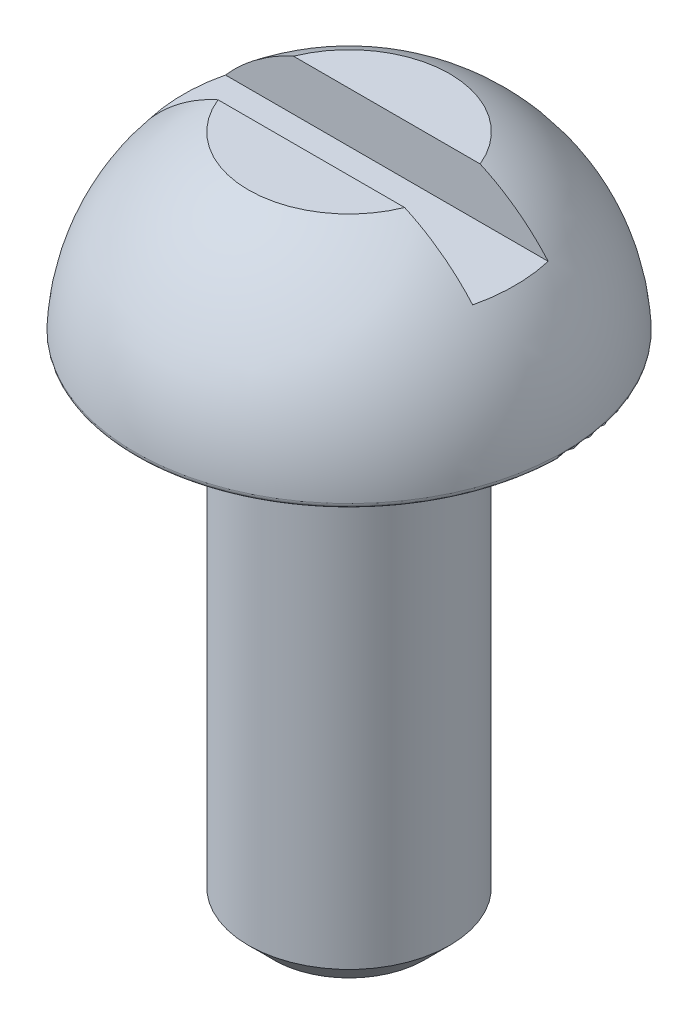
from build123d import *

# Parameters (mm, degrees)
FILLET_1_R          = 0.1
SKETCH_3_W          = 8
SKETCH_3_H          = 1.5
CUT_EXTRUDE_2_DEPTH = 1


with BuildPart() as part:
    # Эскиз1 → Повернуть1 (revolve)
    with BuildSketch(Plane.XY):
        with BuildLine():
            Line((4.25, 10), (2, 10))
            Line((2, 10), (2, 0.5))
            Line((2, 0.5), (1.5, 0))
            Line((1.5, 0), (0, 0))
            Line((0, 0), (0, 13.5))
            Line((0, 13.5), (2, 13.5))
            ThreePointArc((2, 13.5), (3.615901166, 12.065579321), (4.25, 10))
        make_face()
    revolve(axis=Axis((0, 0, 0), (0, 1, 0)))

    # Скругление1
    fillet_1_edges = [part.edges().sort_by_distance(p)[0] for p in [
        (-4.25, 10, 0),
    ]]
    fillet(fillet_1_edges, radius=FILLET_1_R)

    # Эскиз3 → Вырез-Вытянуть2 (cut)
    with BuildSketch(Plane(origin=(0, 13.5, 0), x_dir=(-1, 0, 0), z_dir=(0, 1, 0))):
        Rectangle(SKETCH_3_W, SKETCH_3_H)
    extrude(amount=-CUT_EXTRUDE_2_DEPTH, mode=Mode.SUBTRACT)


solid = part.part
